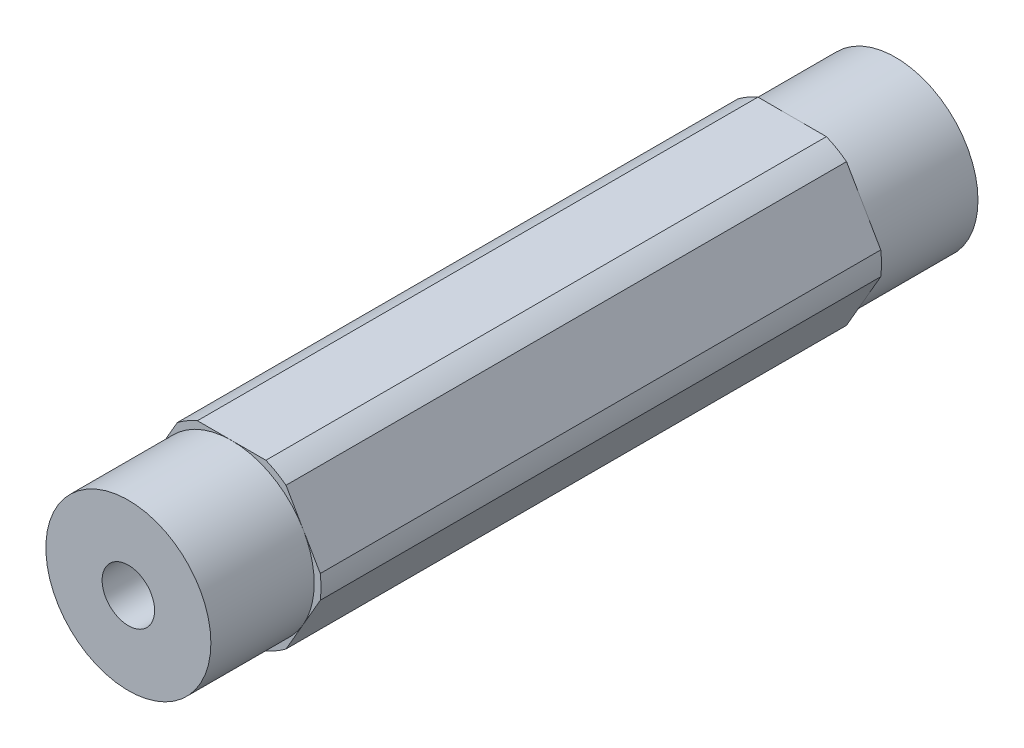
from build123d import *

# Parameters (mm, degrees)
BOSS_EXTRUDE1_DEPTH = 29.51734
SKETCH2_OUTSIDE_W   = 29.092
SKETCH2_OUTSIDE_H   = 27.128
SKETCH2_OUTSIDE_R   = 6.35
CUT_EXTRUDE2_DEPTH  = 7.9502
SKETCH3_OUTSIDE_W   = 29.092
SKETCH3_OUTSIDE_H   = 27.128
SKETCH3_OUTSIDE_R   = 6.875
CUT_EXTRUDE4_DEPTH  = 60.826242369
SKETCH4_R           = 2.0193
CUT_EXTRUDE5_DEPTH  = 60.771912866


with BuildPart() as part:
    # Sketch1 → Boss-Extrude1 (new, symmetric)
    with BuildSketch(Plane.XY):
        Polygon((7.332348419, 0), (3.666174209, 6.35), (-3.666174209, 6.35), (-7.332348419, 0), (-3.666174209, -6.35), (3.666174209, -6.35), align=None)
    extrude(amount=BOSS_EXTRUDE1_DEPTH, both=True)

    # Sketch2 outside → Cut-Extrude2 (cut)
    with BuildSketch(Plane.XY.offset(29.51734)):
        Rectangle(SKETCH2_OUTSIDE_W, SKETCH2_OUTSIDE_H)
        Circle(SKETCH2_OUTSIDE_R, mode=Mode.SUBTRACT)
    cut_extrude2 = extrude(amount=-CUT_EXTRUDE2_DEPTH, mode=Mode.SUBTRACT)

    # Sketch3 outside → Cut-Extrude4 (cut, through all)
    with BuildSketch(Plane.XY.offset(29.51734)):
        Rectangle(SKETCH3_OUTSIDE_W, SKETCH3_OUTSIDE_H)
        Circle(SKETCH3_OUTSIDE_R, mode=Mode.SUBTRACT)
    extrude(amount=-CUT_EXTRUDE4_DEPTH, mode=Mode.SUBTRACT)

    # Mirror1: Cut-Extrude2 across plane
    add(cut_extrude2.mirror(Plane.XY), mode=Mode.SUBTRACT)

    # Sketch4 → Cut-Extrude5 (cut, through all)
    with BuildSketch(Plane.XY.offset(29.51734)):
        Circle(SKETCH4_R)
    extrude(amount=-CUT_EXTRUDE5_DEPTH, mode=Mode.SUBTRACT)


solid = part.part
